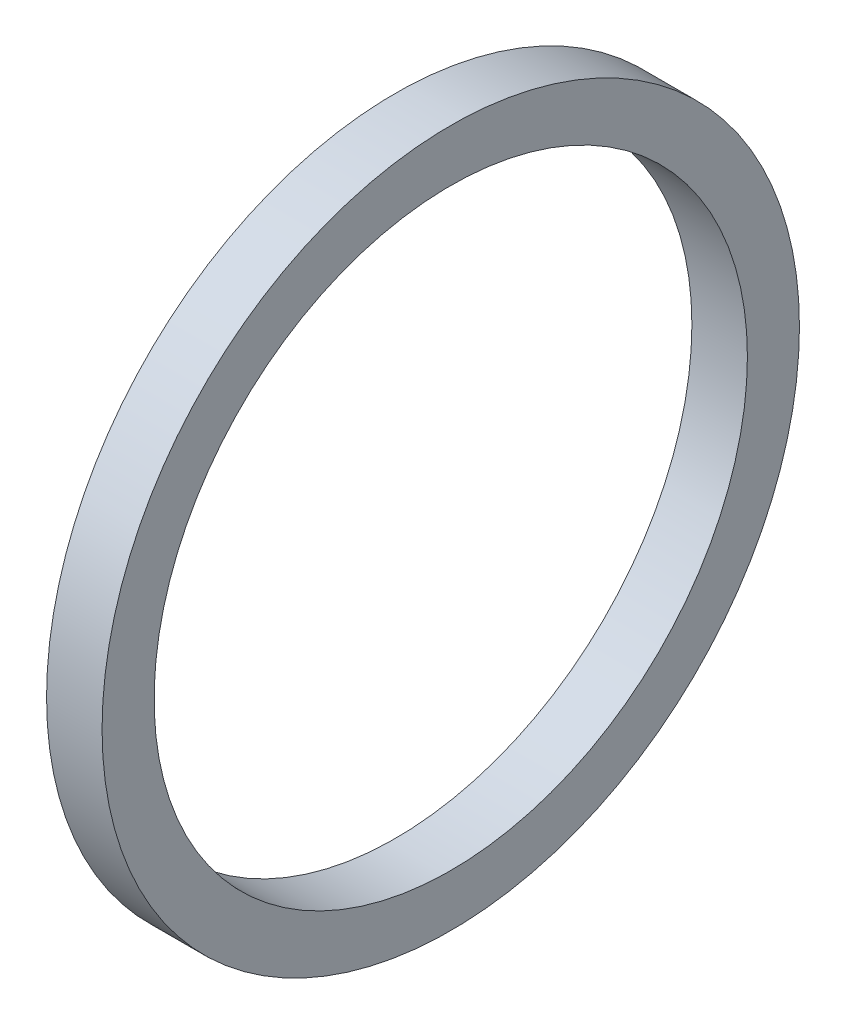
from build123d import *

# Parameters (mm, degrees)
SKETCH1_R           = 20.1
SKETCH1_R_2         = 17.1
EXTRUDE_THIN1_DEPTH = 3.2


with BuildPart() as part:
    # Sketch1 → Extrude-Thin1 (new body)
    with BuildSketch(Plane(origin=(0, 0, 0), x_dir=(0, 0, -1), z_dir=(1, 0, 0))):
        Circle(SKETCH1_R)
        Circle(SKETCH1_R_2, mode=Mode.SUBTRACT)
    extrude(amount=EXTRUDE_THIN1_DEPTH)


solid = part.part
